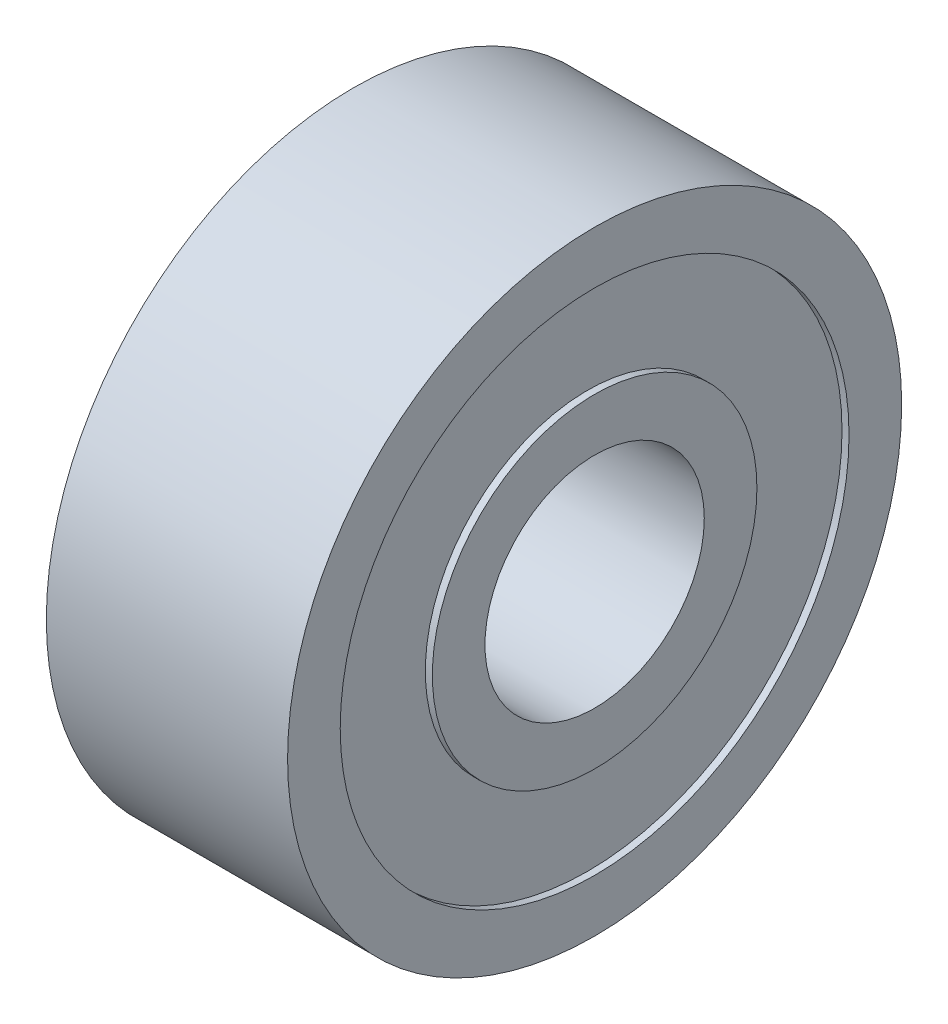
from build123d import *

# Parameters (mm, degrees)
SKETCH1_R           = 11.1125
SKETCH1_R_2         = 3.96875
BOSS_EXTRUDE1_DEPTH = 4.365625
SKETCH2_R           = 9.2075
SKETCH2_R_2         = 5.87375
CUT_EXTRUDE1_DEPTH  = 0.254


with BuildPart() as part:
    # Sketch1 → Boss-Extrude1 (new, symmetric)
    with BuildSketch(Plane(origin=(0, 0, 0), x_dir=(0, 0, -1), z_dir=(1, 0, 0))):
        Circle(SKETCH1_R)
        Circle(SKETCH1_R_2, mode=Mode.SUBTRACT)
    extrude(amount=BOSS_EXTRUDE1_DEPTH, both=True)

    # Sketch2 → Cut-Extrude1 (cut)
    with BuildSketch(Plane(origin=(4.365625, 0, 0), x_dir=(0, 0, -1), z_dir=(1, 0, 0))):
        Circle(SKETCH2_R)
        Circle(SKETCH2_R_2, mode=Mode.SUBTRACT)
    cut_extrude1 = extrude(amount=-CUT_EXTRUDE1_DEPTH, mode=Mode.SUBTRACT)

    # Mirror1: Cut-Extrude1 across plane
    add(cut_extrude1.mirror(Plane(origin=(0, 0, 0), x_dir=(0, 0, 1), z_dir=(1, 0, 0))), mode=Mode.SUBTRACT)


solid = part.part
